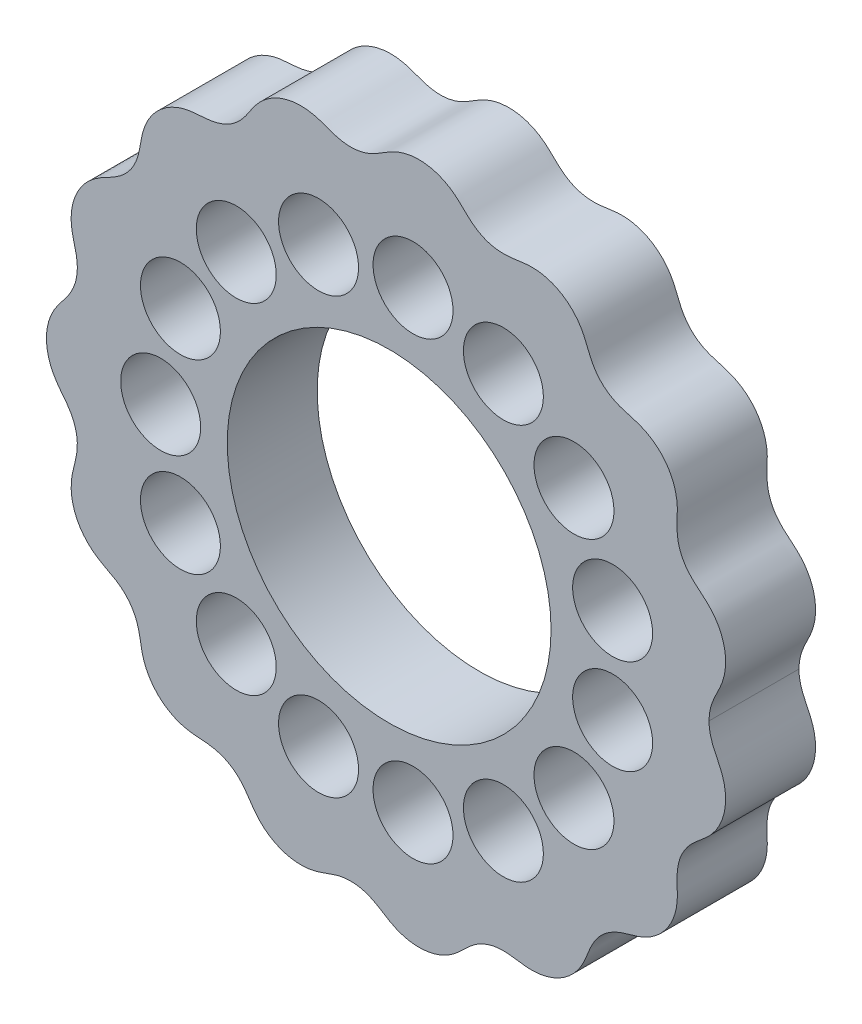
from build123d import *

# Parameters (mm, degrees)
SKETCH2_R           = 9
SKETCH2_R_2         = 2.2225
BOSS_EXTRUDE1_DEPTH = 5


with BuildPart() as part:
    # Sketch2 → Boss-Extrude1 (new body)
    with BuildSketch(Plane.XY):
        with BuildLine():
            add(Edge.make_bspline(
                [(17.78, 0), (17.78, 0.02444985), (17.780737336, 0.067007829), (17.783617718, 0.14351472), (17.792354833, 0.267027191), (17.812718745, 0.435319612), (17.858018385, 0.666154411), (17.944810986, 0.954442929), (18.080968169, 1.280151931), (18.243010651, 1.606258897), (18.451824019, 2.028008741), (18.630460321, 2.525221504), (18.722050857, 3.092630757), (18.698390849, 3.692568973), (18.587702211, 4.211835628), (18.391238946, 4.714479665), (18.108404643, 5.185578615), (17.767907657, 5.573540487), (17.402929311, 5.885411889), (17.007962365, 6.207452317), (16.568197794, 6.628595252), (16.232724906, 7.148109312), (16.052379664, 7.735564683), (16.000061885, 8.250970595), (15.999134289, 8.611573188), (16.020596562, 9.030591658), (16.029209178, 9.510745205), (15.947110954, 10.146061753), (15.663752865, 10.89673582), (15.187136393, 11.547608106), (14.556936002, 12.044271417), (13.976063307, 12.314275268), (13.516105002, 12.451988662), (13.111116775, 12.561616968), (12.769058018, 12.675758649), (12.296677564, 12.888502903), (11.870990787, 13.193074209), (11.525415156, 13.586173164), (11.266179616, 14.03472563), (11.117813855, 14.363413557), (10.966711333, 14.754803525), (10.780519121, 15.197476929), (10.44915044, 15.745612695), (9.957707676, 16.246599831), (9.367065075, 16.62081725), (8.748766475, 16.838082154), (8.239562587, 16.923236936), (7.762294429, 16.929177771), (7.326418367, 16.881177333), (6.849450379, 16.802562018), (6.320634177, 16.755742796), (5.7346413, 16.811472829), (5.126826313, 17.023936526), (4.633748391, 17.346637546), (4.24602316, 17.709312585), (3.915084713, 18.040773256), (3.60671224, 18.307130058), (3.118366443, 18.638727724), (2.432302549, 18.921443711), (1.641380671, 19.019503872), (0.81320502, 18.883662577), (0.221933848, 18.637056845), (-0.1895709, 18.38955021), (-0.5417293, 18.161438959), (-0.854478898, 17.981944678), (-1.326996599, 17.769554932), (-1.925914719, 17.631997316), (-2.543571752, 17.662793393), (-3.128164064, 17.833033195), (-3.604558605, 18.014122378), (-4.057106433, 18.174157431), (-4.685287231, 18.299549554), (-5.492043181, 18.271028191), (-6.264078153, 18.024889104), (-6.936288491, 17.583300443), (-7.377702513, 17.115636419), (-7.652356935, 16.723473452), (-7.881697266, 16.371029073), (-8.096385602, 16.077181788), (-8.447217878, 15.686016106), (-8.873233958, 15.368892347), (-9.360879598, 15.158512897), (-9.875055059, 15.050267148), (-10.236878231, 15.011262876), (-10.656774825, 14.988875472), (-11.133723971, 14.947091034), (-11.759441761, 14.79866014), (-12.477970916, 14.437282499), (-13.077155849, 13.891782719), (-13.505227096, 13.207324568), (-13.710735357, 12.600680822), (-13.79839409, 12.128603087), (-13.865436313, 11.714566796), (-13.944151972, 11.362434243), (-14.108325784, 10.871458944), (-14.368751776, 10.416664071), (-14.725489983, 10.034692396), (-15.218544754, 9.677236671), (-15.669866099, 9.43902653), (-16.179291664, 9.182086708), (-16.760238904, 8.737137855), (-17.268773787, 8.117150702), (-17.594056523, 7.378438399), (-17.709137368, 6.584665044), (-17.652485349, 5.946411039), (-17.541818962, 5.47933626), (-17.41113049, 4.986781241), (-17.323293947, 4.509759531), (-17.321008905, 3.987807541), (-17.430260252, 3.479137071), (-17.590553483, 3.081078187), (-17.787494787, 2.739318203), (-17.998047169, 2.44674148), (-18.214303848, 2.178149432), (-18.415770101, 1.91685113), (-18.590108321, 1.654477042), (-18.734173917, 1.391323395), (-18.847931921, 1.127982806), (-18.923884225, 0.897336219), (-18.972466283, 0.704988273), (-19.002394045, 0.552982789), (-19.021577453, 0.431143902), (-19.034181441, 0.326096536), (-19.041988818, 0.230782253), (-19.047395807, 0.13101452), (-19.049399032, 0.065303859), (-19.05, 0.02612151), (-19.05, 0)],
                knots=[0.076307697, 0.076307697, 0.076307697, 0.076307697, 0.076307697, 0.077887438, 0.079056955, 0.080226472, 0.082565507, 0.087243576, 0.091921645, 0.096599715, 0.101861014, 0.107122314, 0.117644913, 0.125330088, 0.133015263, 0.139766276, 0.146517288, 0.154702114, 0.162886939, 0.167804364, 0.172721789, 0.182556639, 0.196068085, 0.200986124, 0.205904162, 0.2108222, 0.215740238, 0.223925174, 0.232110111, 0.245612081, 0.25911409, 0.267298944, 0.275483798, 0.280401454, 0.285319109, 0.290236765, 0.295154421, 0.308665114, 0.313583116, 0.318501118, 0.323419121, 0.328337123, 0.336522014, 0.344706906, 0.358208896, 0.366269381, 0.374329866, 0.380310597, 0.386291328, 0.392272058, 0.398252789, 0.406737319, 0.41522185, 0.424151679, 0.433081509, 0.43863813, 0.44419475, 0.44975137, 0.45530799, 0.470805706, 0.484307677, 0.492492613, 0.50067755, 0.505595588, 0.510513626, 0.515431664, 0.520349702, 0.533861149, 0.543695999, 0.548613424, 0.553530849, 0.561715674, 0.5699005, 0.583402524, 0.597168642, 0.605268685, 0.613368728, 0.618331904, 0.62329508, 0.628258256, 0.633221432, 0.646998809, 0.651961985, 0.656925161, 0.661888337, 0.666851513, 0.674951557, 0.6830516, 0.696817717, 0.710319742, 0.718504568, 0.726689393, 0.731606818, 0.736524243, 0.741441668, 0.746359093, 0.759870539, 0.764788578, 0.769706616, 0.779542692, 0.787727628, 0.795912565, 0.809414535, 0.822916544, 0.831101398, 0.839286252, 0.844203908, 0.849121563, 0.858956875, 0.865712221, 0.872467568, 0.87738557, 0.882303572, 0.887221575, 0.892139577, 0.896232023, 0.900324468, 0.904416914, 0.90850936, 0.911884858, 0.913572606, 0.915260355, 0.916948104, 0.918635853, 0.919479727, 0.920323601, 0.92201135, 0.92201135, 0.92201135, 0.92201135, 0.92201135], degree=4))
            add(Edge.make_bspline(
                [(17.78, 0), (17.78, -0.024449854), (17.780737336, -0.067007833), (17.783617718, -0.143514724), (17.792354833, -0.267027194), (17.812718744, -0.435319616), (17.858018385, -0.666154415), (17.944810986, -0.954442933), (18.080968169, -1.280151935), (18.243010651, -1.6062589), (18.451824019, -2.028008744), (18.630460321, -2.525221508), (18.722050856, -3.092630761), (18.698390848, -3.692568977), (18.58770221, -4.211835632), (18.391238945, -4.714479669), (18.108404642, -5.185578619), (17.767907656, -5.57354049), (17.40292931, -5.885411892), (17.007962364, -6.20745232), (16.568197793, -6.628595256), (16.232724905, -7.148109315), (16.052379663, -7.735564687), (16.000061884, -8.250970599), (15.999134288, -8.611573191), (16.020596561, -9.030591661), (16.029209177, -9.510745208), (15.947110953, -10.146061756), (15.663752864, -10.896735823), (15.187136392, -11.54760811), (14.556936001, -12.04427142), (13.976063306, -12.314275272), (13.516105001, -12.451988665), (13.111116773, -12.561616971), (12.769058017, -12.675758652), (12.296677563, -12.888502906), (11.870990785, -13.193074212), (11.525415154, -13.586173167), (11.266179614, -14.034725633), (11.117813853, -14.36341356), (10.966711331, -14.754803528), (10.780519119, -15.197476931), (10.449150438, -15.745612698), (9.957707674, -16.246599834), (9.367065073, -16.620817253), (8.748766473, -16.838082157), (8.239562585, -16.923236939), (7.762294428, -16.929177773), (7.326418365, -16.881177336), (6.849450377, -16.80256202), (6.320634175, -16.755742798), (5.734641298, -16.811472831), (5.126826311, -17.023936528), (4.633748389, -17.346637548), (4.246023158, -17.709312587), (3.915084711, -18.040773258), (3.606712238, -18.30713006), (3.118366441, -18.638727725), (2.432302547, -18.921443713), (1.641380669, -19.019503874), (0.813205018, -18.883662579), (0.221933846, -18.637056847), (-0.189570902, -18.389550211), (-0.541729302, -18.16143896), (-0.8544789, -17.98194468), (-1.326996601, -17.769554933), (-1.925914721, -17.631997317), (-2.543571754, -17.662793394), (-3.128164066, -17.833033196), (-3.604558607, -18.01412238), (-4.057106435, -18.174157432), (-4.685287233, -18.299549555), (-5.492043183, -18.271028192), (-6.264078155, -18.024889105), (-6.936288493, -17.583300443), (-7.377702515, -17.11563642), (-7.652356937, -16.723473452), (-7.881697268, -16.371029074), (-8.096385604, -16.077181789), (-8.44721788, -15.686016107), (-8.873233959, -15.368892348), (-9.360879599, -15.158512898), (-9.87505506, -15.050267148), (-10.236878233, -15.011262876), (-10.656774827, -14.988875472), (-11.133723972, -14.947091035), (-11.759441763, -14.79866014), (-12.477970918, -14.437282499), (-13.07715585, -13.891782719), (-13.505227098, -13.207324568), (-13.710735359, -12.600680822), (-13.798394091, -12.128603087), (-13.865436314, -11.714566796), (-13.944151973, -11.362434243), (-14.108325785, -10.871458944), (-14.368751777, -10.416664071), (-14.725489984, -10.034692396), (-15.218544755, -9.677236671), (-15.6698661, -9.43902653), (-16.179291665, -9.182086708), (-16.760238905, -8.737137855), (-17.268773788, -8.117150701), (-17.594056524, -7.378438399), (-17.709137369, -6.584665044), (-17.652485349, -5.946411039), (-17.541818963, -5.479336259), (-17.411130491, -4.98678124), (-17.323293947, -4.509759531), (-17.321008905, -3.987807541), (-17.430260252, -3.479137071), (-17.590553483, -3.081078187), (-17.787494787, -2.739318203), (-17.998047169, -2.44674148), (-18.214303849, -2.178149432), (-18.415770101, -1.916851129), (-18.590108321, -1.654477042), (-18.734173917, -1.391323394), (-18.847931922, -1.127982806), (-18.923884226, -0.897336218), (-18.972466283, -0.704988273), (-19.002394045, -0.552982788), (-19.021577453, -0.431143902), (-19.034181441, -0.326096536), (-19.041988818, -0.230782253), (-19.047395807, -0.131014519), (-19.049399032, -0.065303858), (-19.05, -0.02612151), (-19.05, 0)],
                knots=[0.076307697, 0.076307697, 0.076307697, 0.076307697, 0.076307697, 0.077887438, 0.079056955, 0.080226472, 0.082565507, 0.087243576, 0.091921645, 0.096599715, 0.101861014, 0.107122314, 0.117644913, 0.125330088, 0.133015263, 0.139766276, 0.146517288, 0.154702114, 0.162886939, 0.167804364, 0.172721789, 0.182556639, 0.196068085, 0.200986124, 0.205904162, 0.2108222, 0.215740238, 0.223925174, 0.232110111, 0.245612081, 0.25911409, 0.267298944, 0.275483798, 0.280401454, 0.285319109, 0.290236765, 0.295154421, 0.308665114, 0.313583116, 0.318501118, 0.323419121, 0.328337123, 0.336522014, 0.344706906, 0.358208896, 0.366269381, 0.374329866, 0.380310597, 0.386291328, 0.392272058, 0.398252789, 0.406737319, 0.41522185, 0.424151679, 0.433081509, 0.43863813, 0.44419475, 0.44975137, 0.45530799, 0.470805706, 0.484307677, 0.492492613, 0.50067755, 0.505595588, 0.510513626, 0.515431664, 0.520349702, 0.533861149, 0.543695999, 0.548613424, 0.553530849, 0.561715674, 0.5699005, 0.583402524, 0.597168642, 0.605268685, 0.613368728, 0.618331904, 0.62329508, 0.628258256, 0.633221432, 0.646998809, 0.651961985, 0.656925161, 0.661888337, 0.666851513, 0.674951557, 0.6830516, 0.696817717, 0.710319742, 0.718504568, 0.726689393, 0.731606818, 0.736524243, 0.741441668, 0.746359093, 0.759870539, 0.764788578, 0.769706616, 0.779542692, 0.787727628, 0.795912565, 0.809414535, 0.822916544, 0.831101398, 0.839286252, 0.844203908, 0.849121563, 0.858956875, 0.865712221, 0.872467568, 0.87738557, 0.882303572, 0.887221575, 0.892139577, 0.896232023, 0.900324468, 0.904416914, 0.90850936, 0.911884858, 0.913572606, 0.915260355, 0.916948104, 0.918635853, 0.919479727, 0.920323601, 0.92201135, 0.92201135, 0.92201135, 0.92201135, 0.92201135], degree=4))
        make_face()
        Circle(SKETCH2_R, mode=Mode.SUBTRACT)
        with Locations((-12.7, 0)):
            Circle(SKETCH2_R_2, mode=Mode.SUBTRACT)
        with Locations((-11.602027312, 5.165555367)):
            Circle(SKETCH2_R_2, mode=Mode.SUBTRACT)
        with Locations((-8.497958701, 9.437939284)):
            Circle(SKETCH2_R_2, mode=Mode.SUBTRACT)
        with Locations((-3.924515829, 12.078417757)):
            Circle(SKETCH2_R_2, mode=Mode.SUBTRACT)
        with Locations((1.327511483, 12.630428071)):
            Circle(SKETCH2_R_2, mode=Mode.SUBTRACT)
        with Locations((6.35, 10.998522628)):
            Circle(SKETCH2_R_2, mode=Mode.SUBTRACT)
        with Locations((10.274515829, 7.464872704)):
            Circle(SKETCH2_R_2, mode=Mode.SUBTRACT)
        with Locations((12.422474529, 2.640478473)):
            Circle(SKETCH2_R_2, mode=Mode.SUBTRACT)
        with Locations((12.422474529, -2.640478473)):
            Circle(SKETCH2_R_2, mode=Mode.SUBTRACT)
        with Locations((10.274515829, -7.464872704)):
            Circle(SKETCH2_R_2, mode=Mode.SUBTRACT)
        with Locations((6.35, -10.998522628)):
            Circle(SKETCH2_R_2, mode=Mode.SUBTRACT)
        with Locations((1.327511483, -12.630428071)):
            Circle(SKETCH2_R_2, mode=Mode.SUBTRACT)
        with Locations((-3.924515829, -12.078417757)):
            Circle(SKETCH2_R_2, mode=Mode.SUBTRACT)
        with Locations((-8.497958701, -9.437939284)):
            Circle(SKETCH2_R_2, mode=Mode.SUBTRACT)
        with Locations((-11.602027312, -5.165555367)):
            Circle(SKETCH2_R_2, mode=Mode.SUBTRACT)
    extrude(amount=BOSS_EXTRUDE1_DEPTH)


solid = part.part
